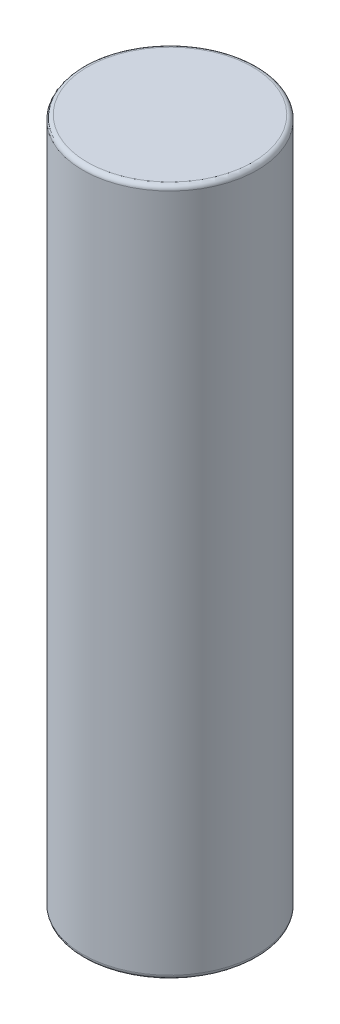
from build123d import *

# Parameters (mm, degrees)
SKETCH1_R           = 4.826
BOSS_EXTRUDE1_DEPTH = 19.05
FILLET1_R           = 0.254


with BuildPart() as part:
    # Sketch1 → Boss-Extrude1 (new, symmetric)
    with BuildSketch(Plane(origin=(0, 0, 0), x_dir=(1, 0, 0), z_dir=(0, 1, 0))):
        with Locations(Location((0, 0, 0), (0, 0, 90))):
            Circle(SKETCH1_R)
    extrude(amount=BOSS_EXTRUDE1_DEPTH, both=True)

    # Fillet1
    fillet1_edges = [part.edges().sort_by_distance(p)[0] for p in [
        (0, -19.05, 4.826),
        (0, 19.05, 4.826),
    ]]
    fillet(fillet1_edges, radius=FILLET1_R)


solid = part.part
